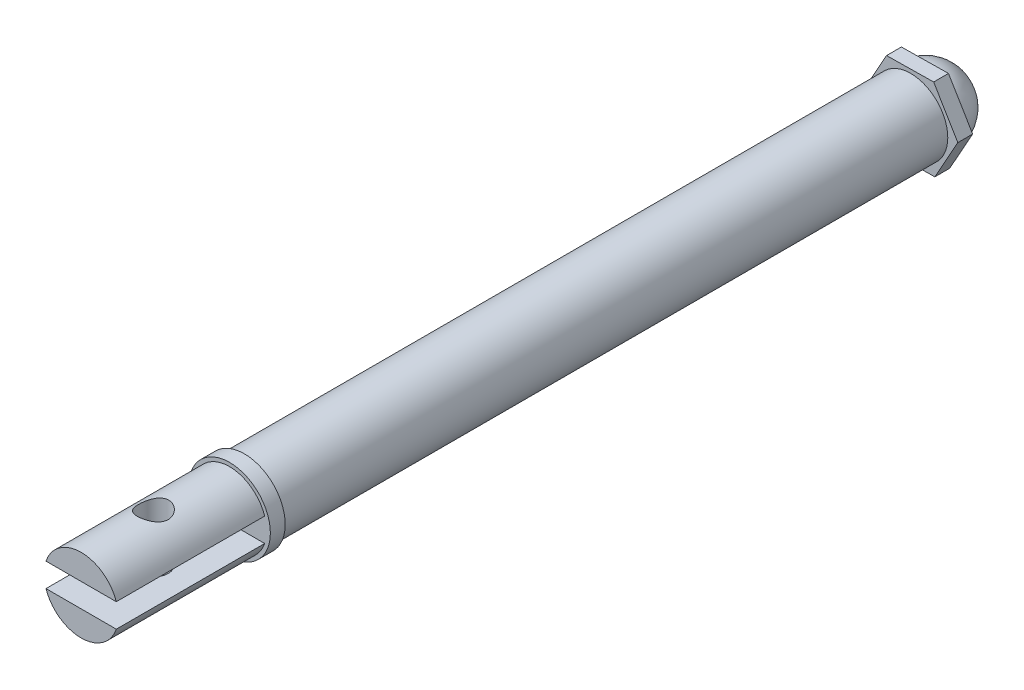
from build123d import *

# Parameters (mm, degrees)
SKETCH1_R               = 2.5
BOSS_EXTRUDE1_DEPTH     = 59.4
CUT_EXTRUDE1_DEPTH      = 10
SKETCH3_R               = 2.75
BOSS_EXTRUDE2_DEPTH     = 1
FILLET1_R               = 2.5
BOSS_EXTRUDE3_DEPTH     = 1
CUT_EXTRUDE2_DEPTH      = 60.549382271
CUT_EXTRUDE2_DEPTH_BACK = 60.549382271
SKETCH5_R               = 1


with BuildPart() as part:
    # Sketch1 → Boss-Extrude1 (new body)
    with BuildSketch(Plane.XY):
        Circle(SKETCH1_R)
    extrude(amount=-BOSS_EXTRUDE1_DEPTH)

    # Sketch2 → Cut-Extrude1 (cut)
    with BuildSketch(Plane.XY):
        with BuildLine():
            Line((-2.368543856, 0.8), (2.368543856, 0.8))
            ThreePointArc((2.368543856, 0.8), (2.5, 0), (2.368543856, -0.8))
            Line((2.368543856, -0.8), (-2.368543856, -0.8))
            ThreePointArc((-2.368543856, -0.8), (-2.5, 0), (-2.368543856, 0.8))
        make_face()
    extrude(amount=-CUT_EXTRUDE1_DEPTH, mode=Mode.SUBTRACT)

    # Sketch3 → Boss-Extrude2 (add)
    with BuildSketch(Plane.XY.offset(-10)):
        Circle(SKETCH3_R)
    extrude(amount=-BOSS_EXTRUDE2_DEPTH)

    # Fillet1
    fillet1_edges = [part.edges().sort_by_distance(p)[0] for p in [
        (-2.5, 0, -59.4),
    ]]
    fillet(fillet1_edges, radius=FILLET1_R)

    # Sketch4 → Boss-Extrude3 (add)
    with BuildSketch(Plane.XY.offset(-56.9)):
        Polygon((1.547782106, 2.772670894), (-1.627312377, 2.726754071), (-3.175094483, -0.045916823), (-1.547782106, -2.772670894), (1.627312377, -2.726754071), (3.175094483, 0.045916823), align=None)
    extrude(amount=BOSS_EXTRUDE3_DEPTH)

    # Sketch5 → Cut-Extrude2 (cut, two sides: drawn at the far end of the back side and taken through both)
    with BuildSketch(Plane(origin=(0, 0, 0), x_dir=(1, 0, 0), z_dir=(0, 1, 0)).offset(-CUT_EXTRUDE2_DEPTH_BACK)):
        with Locations(Location((-0.131456144, 5, 0), (0, 0, 270))):
            Circle(SKETCH5_R)
    extrude(amount=CUT_EXTRUDE2_DEPTH + CUT_EXTRUDE2_DEPTH_BACK, mode=Mode.SUBTRACT)


solid = part.part
